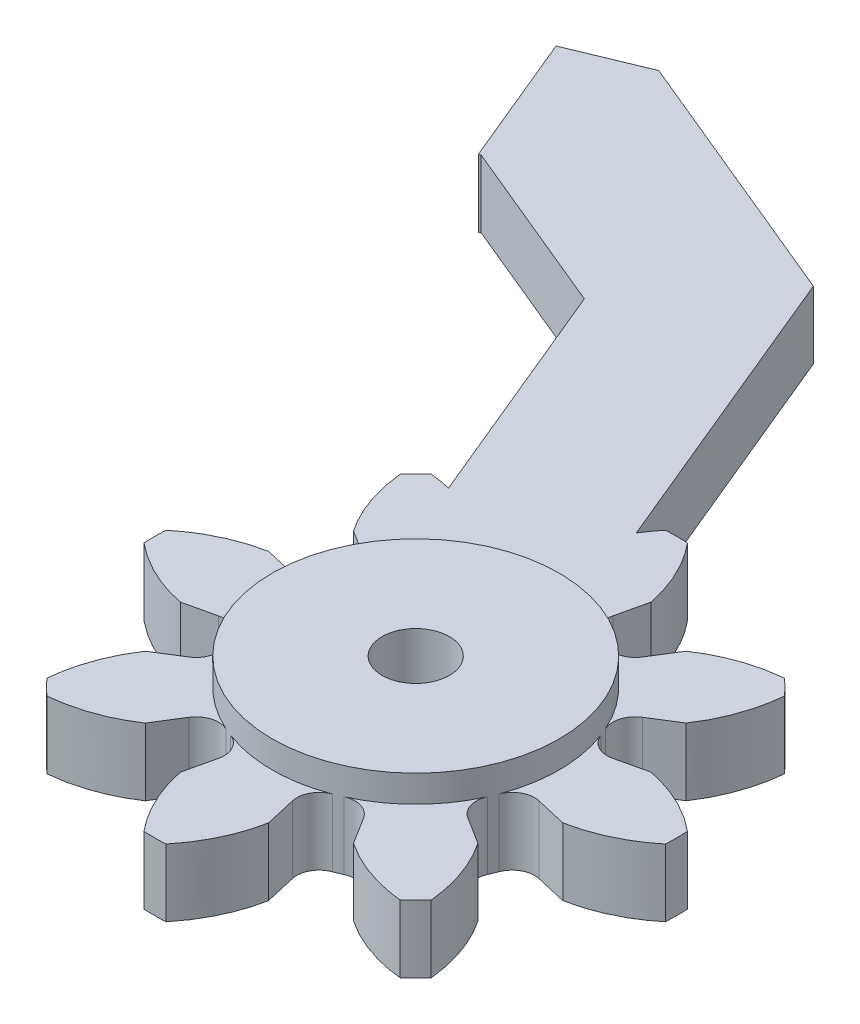
from build123d import *

# Parameters (mm, degrees)
SKETCH1_R           = 6.39375
BOSS_EXTRUDE1_DEPTH = 4.2
BOSS_EXTRUDE2_DEPTH = 3
FILLET1_R           = 1
SKETCH3_R           = 1.5
CUT_EXTRUDE1_DEPTH  = 17.968242557
BOSS_EXTRUDE3_DEPTH = 3
CHAMFER1_SIZE       = 9
CHAMFER2_SIZE       = 6


with BuildPart() as part:
    # Sketch1 → Boss-Extrude1 (new body)
    with BuildSketch(Plane(origin=(0, 0, 0), x_dir=(1, 0, 0), z_dir=(0, 1, 0))):
        with Locations(Location((0, 0, 0), (0, 0, 270))):
            Circle(SKETCH1_R)
    extrude(amount=BOSS_EXTRUDE1_DEPTH)

    # Sketch2 → Boss-Extrude2 (add)
    with BuildSketch(Plane(origin=(0, 0, 0), x_dir=(1, 0, 0), z_dir=(0, 1, 0))):
        with BuildLine():
            Line((-1.433648629, 6.23094621), (-1.959549626, 8.516625387))
            add(Edge.make_bspline(
                [(-1.959549626, 8.516625387), (-1.745269759, 9.644412797), (-1.223586565, 10.731441367), (-0.488991141, 11.614711045)],
                knots=[0, 0, 0, 0, 1, 1, 1, 1], degree=3))
            ThreePointArc((-0.488991141, 11.614711045), (0, 11.625), (0.488991141, 11.614711045))
            add(Edge.make_bspline(
                [(1.959549626, 8.516625387), (1.745269759, 9.644412797), (1.223586565, 10.731441367), (0.488991141, 11.614711045)],
                knots=[0, 0, 0, 0, 1, 1, 1, 1], degree=3))
            Line((1.959549626, 8.516625387), (1.433648629, 6.23094621))
            ThreePointArc((1.433648629, 6.23094621), (0, 6.39375), (-1.433648629, 6.23094621))
        make_face()
        with BuildLine():
            Line((3.392201651, 5.419686986), (4.636552736, 7.407774392))
            add(Edge.make_bspline(
                [(4.636552736, 7.407774392), (5.585537608, 8.053721771), (6.723068605, 8.45348132), (7.86707199, 8.558609894)],
                knots=[0, 0, 0, 0, 1, 1, 1, 1], degree=3))
            ThreePointArc((7.86707199, 8.558609894), (8.220116331, 8.220116331), (8.558609894, 7.86707199))
            add(Edge.make_bspline(
                [(7.407774392, 4.636552736), (8.053721771, 5.585537608), (8.45348132, 6.723068605), (8.558609894, 7.86707199)],
                knots=[0, 0, 0, 0, 1, 1, 1, 1], degree=3))
            Line((7.407774392, 4.636552736), (5.419686986, 3.392201651))
            ThreePointArc((5.419686986, 3.392201651), (4.521063982, 4.521063982), (3.392201651, 5.419686986))
        make_face()
        with BuildLine():
            Line((6.23094621, 1.433648629), (8.516625387, 1.959549626))
            add(Edge.make_bspline(
                [(8.516625387, 1.959549626), (9.644412797, 1.745269759), (10.731441367, 1.223586565), (11.614711045, 0.488991141)],
                knots=[0, 0, 0, 0, 1, 1, 1, 1], degree=3))
            ThreePointArc((11.614711045, 0.488991141), (11.625, 0), (11.614711045, -0.488991141))
            add(Edge.make_bspline(
                [(8.516625387, -1.959549626), (9.644412797, -1.745269759), (10.731441367, -1.223586565), (11.614711045, -0.488991141)],
                knots=[0, 0, 0, 0, 1, 1, 1, 1], degree=3))
            Line((8.516625387, -1.959549626), (6.23094621, -1.433648629))
            ThreePointArc((6.23094621, -1.433648629), (6.39375, 0), (6.23094621, 1.433648629))
        make_face()
        with BuildLine():
            Line((5.419686986, -3.392201651), (7.407774392, -4.636552736))
            add(Edge.make_bspline(
                [(7.407774392, -4.636552736), (8.053721771, -5.585537608), (8.45348132, -6.723068605), (8.558609894, -7.86707199)],
                knots=[0, 0, 0, 0, 1, 1, 1, 1], degree=3))
            ThreePointArc((8.558609894, -7.86707199), (8.220116331, -8.220116331), (7.86707199, -8.558609894))
            add(Edge.make_bspline(
                [(4.636552736, -7.407774392), (5.585537608, -8.053721771), (6.723068605, -8.45348132), (7.86707199, -8.558609894)],
                knots=[0, 0, 0, 0, 1, 1, 1, 1], degree=3))
            Line((4.636552736, -7.407774392), (3.392201651, -5.419686986))
            ThreePointArc((3.392201651, -5.419686986), (4.521063982, -4.521063982), (5.419686986, -3.392201651))
        make_face()
        with BuildLine():
            Line((1.433648629, -6.23094621), (1.959549626, -8.516625387))
            add(Edge.make_bspline(
                [(1.959549626, -8.516625387), (1.745269759, -9.644412797), (1.223586565, -10.731441367), (0.488991141, -11.614711045)],
                knots=[0, 0, 0, 0, 1, 1, 1, 1], degree=3))
            ThreePointArc((0.488991141, -11.614711045), (0, -11.625), (-0.488991141, -11.614711045))
            add(Edge.make_bspline(
                [(-1.959549626, -8.516625387), (-1.745269759, -9.644412797), (-1.223586565, -10.731441367), (-0.488991141, -11.614711045)],
                knots=[0, 0, 0, 0, 1, 1, 1, 1], degree=3))
            Line((-1.959549626, -8.516625387), (-1.433648629, -6.23094621))
            ThreePointArc((-1.433648629, -6.23094621), (0, -6.39375), (1.433648629, -6.23094621))
        make_face()
        with BuildLine():
            Line((-3.392201651, -5.419686986), (-4.636552736, -7.407774392))
            add(Edge.make_bspline(
                [(-4.636552736, -7.407774392), (-5.585537608, -8.053721771), (-6.723068605, -8.45348132), (-7.86707199, -8.558609894)],
                knots=[0, 0, 0, 0, 1, 1, 1, 1], degree=3))
            ThreePointArc((-7.86707199, -8.558609894), (-8.220116331, -8.220116331), (-8.558609894, -7.86707199))
            add(Edge.make_bspline(
                [(-7.407774392, -4.636552736), (-8.053721771, -5.585537608), (-8.45348132, -6.723068605), (-8.558609894, -7.86707199)],
                knots=[0, 0, 0, 0, 1, 1, 1, 1], degree=3))
            Line((-7.407774392, -4.636552736), (-5.419686986, -3.392201651))
            ThreePointArc((-5.419686986, -3.392201651), (-4.521063982, -4.521063982), (-3.392201651, -5.419686986))
        make_face()
        with BuildLine():
            Line((-6.23094621, -1.433648629), (-8.516625387, -1.959549626))
            add(Edge.make_bspline(
                [(-8.516625387, -1.959549626), (-9.644412797, -1.745269759), (-10.731441367, -1.223586565), (-11.614711045, -0.488991141)],
                knots=[0, 0, 0, 0, 1, 1, 1, 1], degree=3))
            ThreePointArc((-11.614711045, -0.488991141), (-11.625, 0), (-11.614711045, 0.488991141))
            add(Edge.make_bspline(
                [(-8.516625387, 1.959549626), (-9.644412797, 1.745269759), (-10.731441367, 1.223586565), (-11.614711045, 0.488991141)],
                knots=[0, 0, 0, 0, 1, 1, 1, 1], degree=3))
            Line((-8.516625387, 1.959549626), (-6.23094621, 1.433648629))
            ThreePointArc((-6.23094621, 1.433648629), (-6.39375, 0), (-6.23094621, -1.433648629))
        make_face()
        with BuildLine():
            Line((-5.419686986, 3.392201651), (-7.407774392, 4.636552736))
            add(Edge.make_bspline(
                [(-7.407774392, 4.636552736), (-8.053721771, 5.585537608), (-8.45348132, 6.723068605), (-8.558609894, 7.86707199)],
                knots=[0, 0, 0, 0, 1, 1, 1, 1], degree=3))
            ThreePointArc((-8.558609894, 7.86707199), (-8.220116331, 8.220116331), (-7.86707199, 8.558609894))
            add(Edge.make_bspline(
                [(-4.636552736, 7.407774392), (-5.585537608, 8.053721771), (-6.723068605, 8.45348132), (-7.86707199, 8.558609894)],
                knots=[0, 0, 0, 0, 1, 1, 1, 1], degree=3))
            Line((-4.636552736, 7.407774392), (-3.392201651, 5.419686986))
            ThreePointArc((-3.392201651, 5.419686986), (-4.521063982, 4.521063982), (-5.419686986, 3.392201651))
        make_face()
    extrude(amount=BOSS_EXTRUDE2_DEPTH)

    # Fillet1
    fillet1_edges = [part.edges().sort_by_distance(p)[0] for p in [
        (-5.419686986, 1.5, -3.392201651),
        (-3.392201651, 1.5, -5.419686986),
        (3.392201651, 1.5, -5.419686986),
        (5.419686986, 1.5, -3.392201651),
        (6.23094621, 1.5, -1.433648629),
        (6.23094621, 1.5, 1.433648629),
        (5.419686986, 1.5, 3.392201651),
        (3.392201651, 1.5, 5.419686986),
        (1.433648629, 1.5, 6.23094621),
        (-1.433648629, 1.5, 6.23094621),
        (-3.392201651, 1.5, 5.419686986),
        (-5.419686986, 1.5, 3.392201651),
        (-1.433648629, 1.5, -6.23094621),
        (1.433648629, 1.5, -6.23094621),
        (-6.23094621, 1.5, 1.433648629),
        (-6.23094621, 1.5, -1.433648629),
    ]]
    fillet(fillet1_edges, radius=FILLET1_R)

    # Sketch3 → Cut-Extrude1 (cut, through all)
    with BuildSketch(Plane(origin=(0, 4.2, 0), x_dir=(1, 0, 0), z_dir=(0, 1, 0))):
        with Locations(Location((0, 0, 0), (0, 0, 270))):
            Circle(SKETCH3_R)
    extrude(amount=-CUT_EXTRUDE1_DEPTH, mode=Mode.SUBTRACT)

    # Sketch4 → Boss-Extrude3 (add)
    with BuildSketch(Plane.XZ):
        Polygon((1.425680775, -4.920105114), (-4.487148233, -2.470931146), (-13.518477237, -24.274488114), (-19.154142386, -21.940119176), (-21.603316353, -27.852948184), (-10.054822196, -32.636491089), align=None)
    extrude(amount=-BOSS_EXTRUDE3_DEPTH)

    # Chamfer1
    chamfer1_edges = [part.edges().sort_by_distance(p)[0] for p in [
        (-10.054822196, 1.5, -32.636491089),
    ]]
    chamfer(chamfer1_edges, length=CHAMFER1_SIZE)

    # Chamfer2
    chamfer2_edges = [part.edges().sort_by_distance(p)[0] for p in [
        (-13.518477237, 1.5, -24.274488114),
    ]]
    chamfer(chamfer2_edges, length=CHAMFER2_SIZE)


solid = part.part
